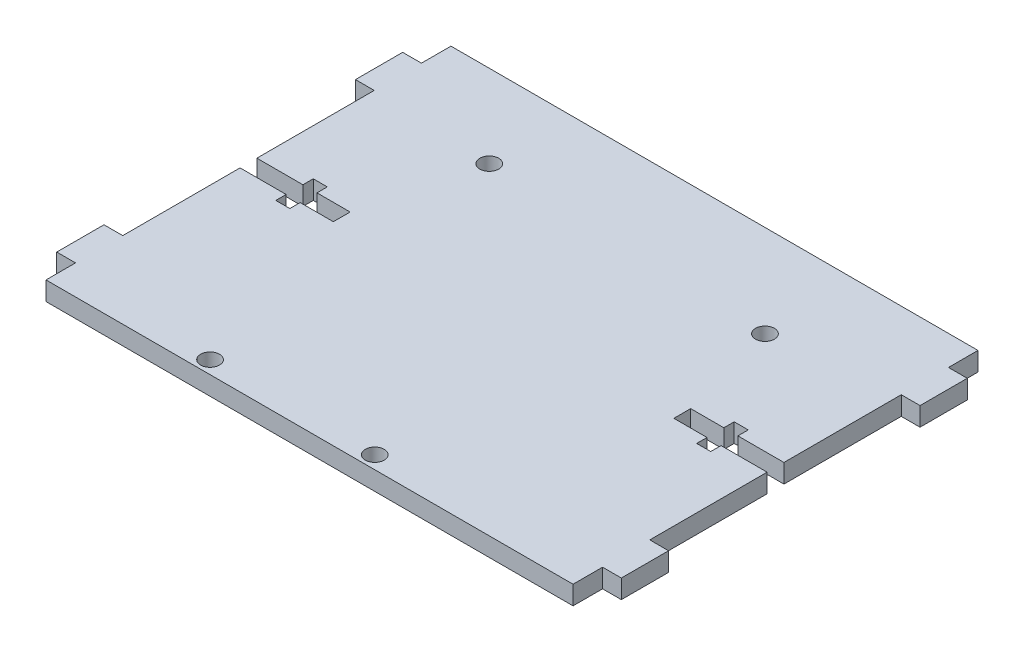
from build123d import *

# Parameters (mm, degrees)
SKETCH1_R           = 1.6
BOSS_EXTRUDE1_DEPTH = 3.18
CUT_EXTRUDE1_DEPTH  = 71.077005804


with BuildPart() as part:
    # Sketch1 → Boss-Extrude1 (new body)
    with BuildSketch(Plane(origin=(0, 0, 0), x_dir=(1, 0, 0), z_dir=(0, 1, 0))):
        Polygon((44.64191244, 17.475260069), (-44.64191244, 17.475260069), (-44.64191244, 12.475260069), (-47.82191244, 12.475260069), (-47.82191244, 4.475260069), (-44.64191244, 4.475260069), (-44.64191244, -38.124739931), (-47.82191244, -38.124739931), (-47.82191244, -46.124739931), (-44.64191244, -46.124739931), (-44.64191244, -51.124739931), (44.64191244, -51.124739931), (44.64191244, -46.124739931), (47.82191244, -46.124739931), (47.82191244, -38.124739931), (44.64191244, -38.124739931), (44.64191244, 4.475260069), (47.82191244, 4.475260069), (47.82191244, 12.475260069), (44.64191244, 12.475260069), align=None)
        with Locations(Location((24.15, 1.875260069, 0), (0, 0, 90))):
            Circle(SKETCH1_R, mode=Mode.SUBTRACT)
        with Locations(Location((8.85, -48.924739931, 0), (0, 0, 90))):
            Circle(SKETCH1_R, mode=Mode.SUBTRACT)
        with Locations(Location((-19.05, -48.924739931, 0), (0, 0, 90))):
            Circle(SKETCH1_R, mode=Mode.SUBTRACT)
        with Locations(Location((-24.15, 3.475260069, 0), (0, 0, 90))):
            Circle(SKETCH1_R, mode=Mode.SUBTRACT)
    extrude(amount=BOSS_EXTRUDE1_DEPTH)

    # Sketch2 → Cut-Extrude1 (cut, through all)
    with BuildSketch(Plane(origin=(0, 3.18, 0), x_dir=(1, 0, 0), z_dir=(0, 1, 0))):
        Polygon((-44.64191244, -15.399739931), (-36.84191244, -15.399739931), (-36.84191244, -13.649739931), (-34.46191244, -13.649739931), (-34.46191244, -15.399739931), (-28.84191244, -15.399739931), (-28.84191244, -18.249739931), (-34.46191244, -18.249739931), (-34.46191244, -19.999739931), (-36.84191244, -19.999739931), (-36.84191244, -18.249739931), (-44.64191244, -18.249739931), align=None)
    cut_extrude1 = extrude(amount=-CUT_EXTRUDE1_DEPTH, mode=Mode.SUBTRACT)

    # Mirror1: Cut-Extrude1 across plane
    add(cut_extrude1.mirror(Plane(origin=(0, 0, 0), x_dir=(0, 0, 1), z_dir=(1, 0, 0))), mode=Mode.SUBTRACT)


solid = part.part
